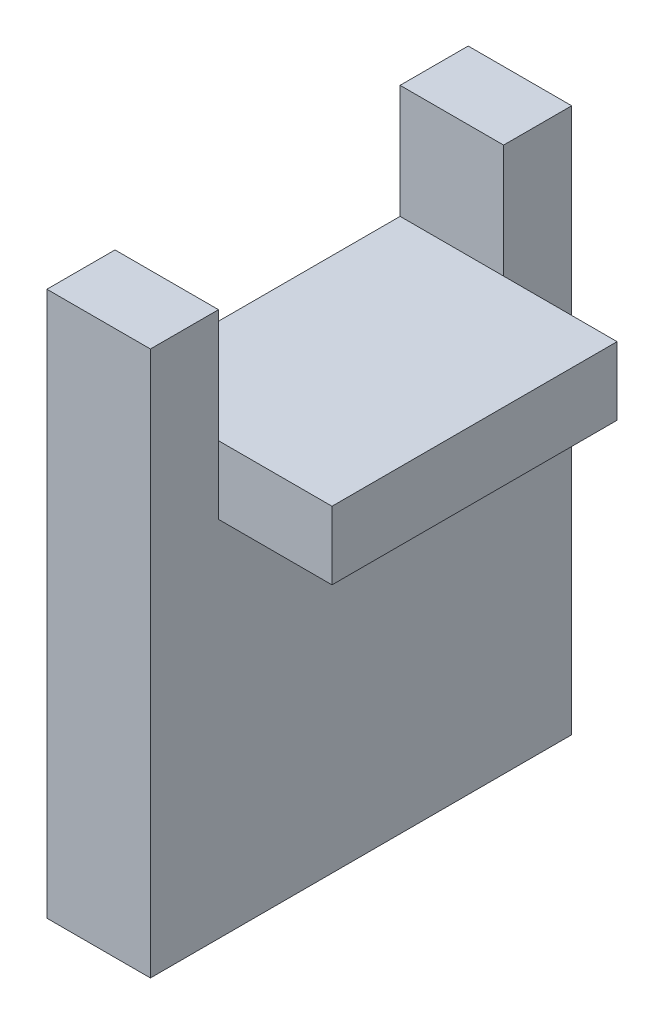
from build123d import *

# Parameters (mm, degrees)
SKETCH1_W           = 4.56
SKETCH1_H           = 18.56
BOSS_EXTRUDE2_DEPTH = 24
SKETCH2_W           = 4.56
SKETCH2_H           = 12.56
CUT_EXTRUDE1_DEPTH  = 5
SKETCH3_W           = 12.56
SKETCH3_H           = 3
BOSS_EXTRUDE3_DEPTH = 5


with BuildPart() as part:
    # Sketch1 → Boss-Extrude2 (new body)
    with BuildSketch(Plane(origin=(0, 0, 0), x_dir=(1, 0, 0), z_dir=(0, 1, 0))):
        with Locations((2.28, 9.28)):
            Rectangle(SKETCH1_W, SKETCH1_H)
    extrude(amount=BOSS_EXTRUDE2_DEPTH)

    # Sketch2 → Cut-Extrude1 (cut)
    with BuildSketch(Plane(origin=(0, 24, 0), x_dir=(1, 0, 0), z_dir=(0, 1, 0))):
        with Locations((2.28, 9.28)):
            Rectangle(SKETCH2_W, SKETCH2_H)
    extrude(amount=-CUT_EXTRUDE1_DEPTH, mode=Mode.SUBTRACT)

    # Sketch3 → Boss-Extrude3 (add)
    with BuildSketch(Plane(origin=(4.56, 0, 0), x_dir=(0, 0, -1), z_dir=(1, 0, 0))):
        with Locations((9.28, 17.5)):
            Rectangle(SKETCH3_W, SKETCH3_H)
    extrude(amount=BOSS_EXTRUDE3_DEPTH)


solid = part.part
